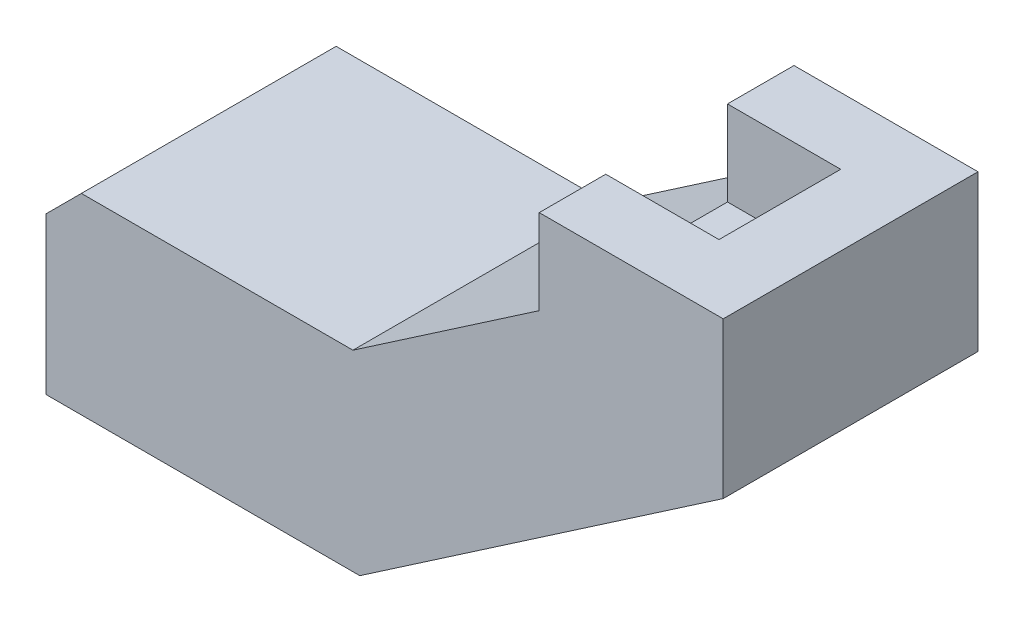
from build123d import *

# Parameters (mm, degrees)
BOSS_EXTRUDE1_DEPTH      = 5
BOSS_EXTRUDE1_DEPTH_BACK = 13
SKETCH2_R                = 1.5
CUT_EXTRUDE1_DEPTH       = 66.915554427
SKETCH4_W                = 8
SKETCH4_H                = 4.7
BOSS_EXTRUDE2_DEPTH      = 6
CUT_EXTRUDE3_START       = -5
CUT_EXTRUDE3_DEPTH       = 61.915554427
CUT_EXTRUDE4_DEPTH       = 68.080998169
CHAMFER1_SIZE            = 2.5


with BuildPart() as part:
    # Sketch1 → Boss-Extrude1 (new, two sides: drawn at the far end of the back side and taken through both)
    with BuildSketch(Plane.XY.offset(-BOSS_EXTRUDE1_DEPTH_BACK)):
        Polygon((0, 6), (5, 6), (5, -5), (-20.67950334, -22.556349186), (-49.056349186, -22.556349186), (-60.556349186, -11.056349186), (-46.414213562, 3.085786438), (-34.328427125, -9), (-21.164213562, -9), (-8, 0), (0, 0), align=None)
    extrude(amount=BOSS_EXTRUDE1_DEPTH + BOSS_EXTRUDE1_DEPTH_BACK)

    # Sketch2 → Cut-Extrude1 (cut, through all)
    with BuildSketch(Plane(origin=(0, 0, 0), x_dir=(1, 0, 0), z_dir=(0, 1, 0))):
        with Locations(Location((-3, 3.95, 0), (0, 0, 270))):
            Circle(SKETCH2_R)
    extrude(amount=-CUT_EXTRUDE1_DEPTH, mode=Mode.SUBTRACT)

    # Sketch4 → Boss-Extrude2 (add)
    with BuildSketch(Plane(origin=(0, 0, 0), x_dir=(1, 0, 0), z_dir=(0, 1, 0))):
        with Locations((-4, -2.65)):
            Rectangle(SKETCH4_W, SKETCH4_H)
        with Locations((-4, 10.65)):
            Rectangle(SKETCH4_W, SKETCH4_H)
    extrude(amount=BOSS_EXTRUDE2_DEPTH)

    # Sketch5 → Cut-Extrude3 (cut, through all)
    with BuildSketch(Plane(origin=(0, 0, 0), x_dir=(1, 0, 0), z_dir=(0, 1, 0)).offset(CUT_EXTRUDE3_START)):
        Polygon((-1.267949192, 0.95), (-4.732050808, 0.95), (-6.464101615, 3.95), (-4.732050808, 6.95), (-1.267949192, 6.95), (0.464101615, 3.95), align=None)
    extrude(amount=-CUT_EXTRUDE3_DEPTH, mode=Mode.SUBTRACT)

    # Sketch6 → Cut-Extrude4 (cut, through all)
    with BuildSketch(Plane.XY.offset(5)):
        Polygon((-42.85, -22.556349186), (-49.056349186, -22.556349186), (-60.556349186, -11.056349186), (-46.414213562, 3.085786438), (-34.328427125, -9), (-42.85, -9), align=None)
    extrude(amount=-CUT_EXTRUDE4_DEPTH, mode=Mode.SUBTRACT)

    # Sketch7 → Cut-Revolve1 (revolve, cut)
    with BuildSketch(Plane.XY.offset(-3.95), mode=Mode.PRIVATE) as cut_revolve1_sk:
        Polygon((-24.85, -15.1), (-25.85, -15.1), (-45.997007673, -15.1), (-45.997007673, -12), (-39.790264322, -12), (-38.290264322, -12.35), (-25.85, -12.35), (-24.85, -12.85), align=None)
    revolve(cut_revolve1_sk.sketch.rotate(Axis((-45.997007673, -15.1, -3.95), (1, 0, 0)), 180), axis=Axis((-45.997007673, -15.1, -3.95), (1, 0, 0)), mode=Mode.SUBTRACT)

    # Chamfer1
    chamfer1_edges = [part.edges().sort_by_distance(p)[0] for p in [
        (-42.85, -9, -4),
    ]]
    chamfer(chamfer1_edges, length=CHAMFER1_SIZE)


solid = part.part
